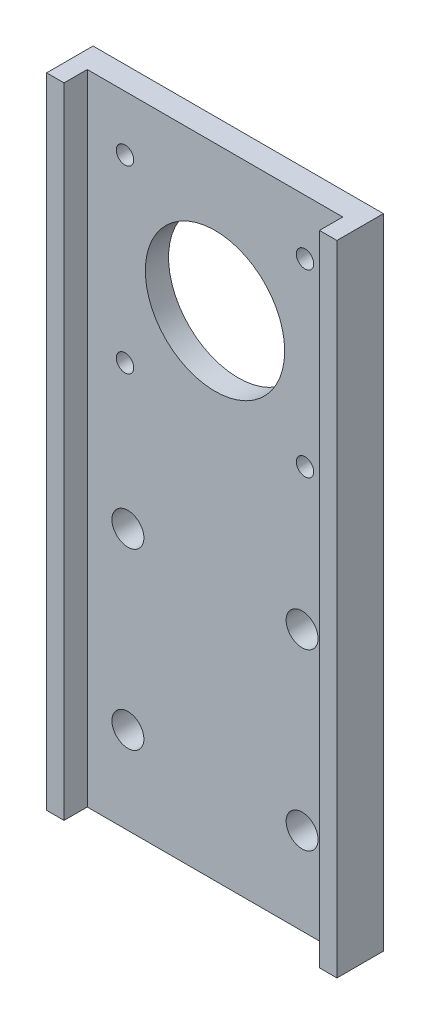
from build123d import *

# Parameters (mm, degrees)
SKETCH1_W           = 50
SKETCH1_H           = 110
BOSS_EXTRUDE1_DEPTH = 4
CUT_EXTRUDE1_REACH  = 62.548
SKETCH2_R           = 1.5
CUT_EXTRUDE2_REACH  = 62.548
SKETCH3_R           = 2.75
SKETCH4_W           = 3
SKETCH4_H           = 110
BOSS_EXTRUDE2_DEPTH = 8
CUT_EXTRUDE3_REACH  = 62.943
SKETCH5_R           = 12


with BuildPart() as part:
    # Sketch1 → Boss-Extrude1 (new body)
    with BuildSketch(Plane.XY):
        Rectangle(SKETCH1_W, SKETCH1_H)
    extrude(amount=BOSS_EXTRUDE1_DEPTH)

    # Sketch2 → Cut-Extrude1 (cut, up to next)
    with BuildSketch(Plane.XY, mode=Mode.PRIVATE) as cut_extrude1_sk1:
        with Locations((-15.5, 45.5)):
            Circle(SKETCH2_R)
    cut_extrude1_tool1 = extrude(cut_extrude1_sk1.sketch, amount=CUT_EXTRUDE1_REACH, mode=Mode.PRIVATE) & part.part
    # Sketch2 → Cut-Extrude1 (cut, up to next)
    with BuildSketch(Plane.XY, mode=Mode.PRIVATE) as cut_extrude1_sk2:
        with Locations((-15.5, 14.5)):
            Circle(SKETCH2_R)
    cut_extrude1_tool2 = extrude(cut_extrude1_sk2.sketch, amount=CUT_EXTRUDE1_REACH, mode=Mode.PRIVATE) & part.part
    # Sketch2 → Cut-Extrude1 (cut, up to next)
    with BuildSketch(Plane.XY, mode=Mode.PRIVATE) as cut_extrude1_sk3:
        with Locations(Location((15.5, 14.5, 0), (0, 0, 180))):
            Circle(SKETCH2_R)
    cut_extrude1_tool3 = extrude(cut_extrude1_sk3.sketch, amount=CUT_EXTRUDE1_REACH, mode=Mode.PRIVATE) & part.part
    # Sketch2 → Cut-Extrude1 (cut, up to next)
    with BuildSketch(Plane.XY, mode=Mode.PRIVATE) as cut_extrude1_sk4:
        with Locations(Location((15.5, 45.5, 0), (0, 0, 180))):
            Circle(SKETCH2_R)
    cut_extrude1_tool4 = extrude(cut_extrude1_sk4.sketch, amount=CUT_EXTRUDE1_REACH, mode=Mode.PRIVATE) & part.part
    add(cut_extrude1_tool1.solids().sort_by_distance((-15.5, 45.5, 0))[0], mode=Mode.SUBTRACT)
    add(cut_extrude1_tool2.solids().sort_by_distance((-15.5, 14.5, 0))[0], mode=Mode.SUBTRACT)
    add(cut_extrude1_tool3.solids().sort_by_distance((15.5, 14.5, 0))[0], mode=Mode.SUBTRACT)
    add(cut_extrude1_tool4.solids().sort_by_distance((15.5, 45.5, 0))[0], mode=Mode.SUBTRACT)

    # Sketch3 → Cut-Extrude2 (cut, up to next)
    with BuildSketch(Plane.XY, mode=Mode.PRIVATE) as cut_extrude2_sk1:
        with Locations((-15, -40)):
            Circle(SKETCH3_R)
    cut_extrude2_tool1 = extrude(cut_extrude2_sk1.sketch, amount=CUT_EXTRUDE2_REACH, mode=Mode.PRIVATE) & part.part
    # Sketch3 → Cut-Extrude2 (cut, up to next)
    with BuildSketch(Plane.XY, mode=Mode.PRIVATE) as cut_extrude2_sk2:
        with Locations((-15, -10)):
            Circle(SKETCH3_R)
    cut_extrude2_tool2 = extrude(cut_extrude2_sk2.sketch, amount=CUT_EXTRUDE2_REACH, mode=Mode.PRIVATE) & part.part
    # Sketch3 → Cut-Extrude2 (cut, up to next)
    with BuildSketch(Plane.XY, mode=Mode.PRIVATE) as cut_extrude2_sk3:
        with Locations(Location((15, -40, 0), (0, 0, 180))):
            Circle(SKETCH3_R)
    cut_extrude2_tool3 = extrude(cut_extrude2_sk3.sketch, amount=CUT_EXTRUDE2_REACH, mode=Mode.PRIVATE) & part.part
    # Sketch3 → Cut-Extrude2 (cut, up to next)
    with BuildSketch(Plane.XY, mode=Mode.PRIVATE) as cut_extrude2_sk4:
        with Locations(Location((15, -10, 0), (0, 0, 180))):
            Circle(SKETCH3_R)
    cut_extrude2_tool4 = extrude(cut_extrude2_sk4.sketch, amount=CUT_EXTRUDE2_REACH, mode=Mode.PRIVATE) & part.part
    add(cut_extrude2_tool1.solids().sort_by_distance((-15, -40, 0))[0], mode=Mode.SUBTRACT)
    add(cut_extrude2_tool2.solids().sort_by_distance((-15, -10, 0))[0], mode=Mode.SUBTRACT)
    add(cut_extrude2_tool3.solids().sort_by_distance((15, -40, 0))[0], mode=Mode.SUBTRACT)
    add(cut_extrude2_tool4.solids().sort_by_distance((15, -10, 0))[0], mode=Mode.SUBTRACT)

    # Sketch4 → Boss-Extrude2 (add)
    with BuildSketch(Plane.XY):
        with Locations((-23.5, 0)):
            Rectangle(SKETCH4_W, SKETCH4_H)
        with Locations((23.5, 0)):
            Rectangle(SKETCH4_W, SKETCH4_H)
    extrude(amount=BOSS_EXTRUDE2_DEPTH)

    # Sketch5 → Cut-Extrude3 (cut, up to next)
    with BuildSketch(Plane.XY, mode=Mode.PRIVATE) as cut_extrude3_sk1:
        with Locations((0, 30)):
            Circle(SKETCH5_R)
    cut_extrude3_tool1 = extrude(cut_extrude3_sk1.sketch, amount=CUT_EXTRUDE3_REACH, mode=Mode.PRIVATE) & part.part
    add(cut_extrude3_tool1.solids().sort_by_distance((0, 30, 0))[0], mode=Mode.SUBTRACT)


solid = part.part
